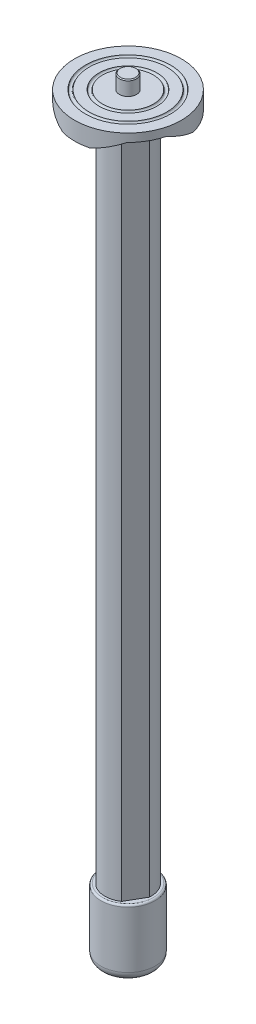
from build123d import *

# Parameters (mm, degrees)
EXTRUDE1_DEPTH      = 185
SKETCH3_R           = 29.5
EXTRUDE2_DEPTH      = 10
SKETCH7_R           = 1
SKETCH6_OUTSIDE_W   = 138.81
SKETCH6_OUTSIDE_H   = 138.81
SKETCH6_OUTSIDE_R   = 29.5
SKETCH6_OUTSIDE_R_2 = 25.5
EXTRUDE4_DEPTH      = 5.5
EXTRUDE3_DEPTH      = 23
CIRPATTERN1_COUNT   = 3
SKETCH8_R           = 4.7625
EXTRUDE5_DEPTH      = 8
CHAMFER1_SIZE       = 0.5
EXTRUDE6_DEPTH      = 8
FILLET1_R           = 5
FILLET2_R           = 1


with BuildPart() as part:
    # Sketch2 → Extrude1 (new, symmetric)
    with BuildSketch(Plane(origin=(0, 0, 0), x_dir=(1, 0, 0), z_dir=(0, 1, 0))):
        with BuildLine():
            Line((-5.6, 11.45436598), (5.6, 11.45436598))
            ThreePointArc((5.6, 11.45436598), (11.041823898, 6.375), (12.719771923, -0.877440729))
            Line((12.719771923, -0.877440729), (7.119771923, -10.576925251))
            ThreePointArc((7.119771923, -10.576925251), (0, -12.75), (-7.119771923, -10.576925251))
            Line((-7.119771923, -10.576925251), (-12.719771923, -0.877440729))
            ThreePointArc((-12.719771923, -0.877440729), (-11.041823898, 6.375), (-5.6, 11.45436598))
        make_face()
    extrude(amount=EXTRUDE1_DEPTH, both=True)


with BuildPart() as body_2:
    # Sketch3 → Extrude2 (new body)
    with BuildSketch(Plane(origin=(0, 185, 0), x_dir=(1, 0, 0), z_dir=(0, 1, 0))):
        with Locations(Location((0, 0, 0), (0, 0, 270))):
            Circle(SKETCH3_R)
    extrude(amount=EXTRUDE2_DEPTH)

    # Sketch7 → Cut-Revolve1 (revolve, cut)
    with BuildSketch(Plane.XY, mode=Mode.PRIVATE) as cut_revolve1_sk:
        with Locations((15, 195)):
            Circle(SKETCH7_R)
        with Locations((22.5, 195)):
            Circle(SKETCH7_R)
    revolve(cut_revolve1_sk.sketch.rotate(Axis((0, 203.822792645, 0), (0, -1, 0)), 90), axis=Axis((0, 203.822792645, 0), (0, -1, 0)), mode=Mode.SUBTRACT)

    # Sketch6 outside → Extrude4 (cut)
    # profile 1 of 2: a face of its own
    with BuildSketch(Plane.XZ.offset(-185)):
        Rectangle(SKETCH6_OUTSIDE_W, SKETCH6_OUTSIDE_H)
        with Locations(Location((0, 0, 0), (0, 0, 90))):
            Circle(SKETCH6_OUTSIDE_R, mode=Mode.SUBTRACT)
    # profile 2 of 2: a face of its own
    with BuildSketch(Plane.XZ.offset(-185)):
        with Locations(Location((0, 0, 0), (0, 0, 270))):
            Circle(SKETCH6_OUTSIDE_R_2)
    extrude(amount=-EXTRUDE4_DEPTH, mode=Mode.SUBTRACT)

    # Sketch4 → Extrude3 (cut)
    with BuildSketch(Plane.XY.offset(-35)):
        Polygon((8, 190.5), (-8, 190.5), (-21, 185), (21, 185), align=None)
    extrude3 = extrude(amount=EXTRUDE3_DEPTH, mode=Mode.SUBTRACT)

    # CirPattern1: Extrude3 ×3 about axis
    cirpattern1_axis = Axis((0, 0, 0), (0, 1, 0))
    for i in range(1, CIRPATTERN1_COUNT):
        add(extrude3.rotate(cirpattern1_axis, i * 360 / CIRPATTERN1_COUNT), mode=Mode.SUBTRACT)


with BuildPart() as body_3:
    # Sketch8 → Extrude5 (new body)
    with BuildSketch(Plane(origin=(0, 195, 0), x_dir=(1, 0, 0), z_dir=(0, 1, 0))):
        with Locations(Location((0, 0, 0), (0, 0, 270))):
            Circle(SKETCH8_R)
    extrude(amount=EXTRUDE5_DEPTH)

    # Chamfer1
    chamfer1_edges = [body_3.edges().sort_by_distance(p)[0] for p in [
        (0, 203, -4.7625),
    ]]
    chamfer(chamfer1_edges, length=CHAMFER1_SIZE)


with BuildPart() as body_4:
    # Sketch9 → Extrude6 (new body)
    with BuildSketch(Plane(origin=(0, 185, 0), x_dir=(1, 0, 0), z_dir=(0, 1, 0))):
        with BuildLine():
            Line((-12.719771923, -0.877440729), (-7.119771923, -10.576925251))
            ThreePointArc((-7.119771923, -10.576925251), (0, -12.75), (7.119771923, -10.576925251))
            Line((7.119771923, -10.576925251), (12.719771923, -0.877440729))
            ThreePointArc((12.719771923, -0.877440729), (11.041823898, 6.375), (5.6, 11.45436598))
            Line((5.6, 11.45436598), (-5.6, 11.45436598))
            ThreePointArc((-5.6, 11.45436598), (-11.041823898, 6.375), (-12.719771923, -0.877440729))
        make_face()
    extrude(amount=EXTRUDE6_DEPTH)

    # Combine1: union part
    add(part.part)


with BuildPart() as body_5:
    # Sketch10 → Revolve1 (revolve)
    with BuildSketch(Plane.XY, mode=Mode.PRIVATE) as revolve1_sk:
        with BuildLine():
            Line((15, -185), (15, -220))
            ThreePointArc((15, -220), (7.90569415, -223.717082451), (0, -225))
            Line((0, -225), (0, -185))
            Line((0, -185), (15, -185))
        make_face()
    revolve(revolve1_sk.sketch.rotate(Axis((0, -185, 0), (0, -1, 0)), 180), axis=Axis((0, -185, 0), (0, -1, 0)))

    # Fillet1
    fillet1_edges = [body_5.edges().sort_by_distance(p)[0] for p in [
        (15, -220, 0),
    ]]
    fillet(fillet1_edges, radius=FILLET1_R)

    # Fillet2
    fillet2_edges = [body_5.edges().sort_by_distance(p)[0] for p in [
        (15, -185, 0),
    ]]
    fillet(fillet2_edges, radius=FILLET2_R)


solid = Compound([body_2.part, body_3.part, body_4.part, body_5.part])
